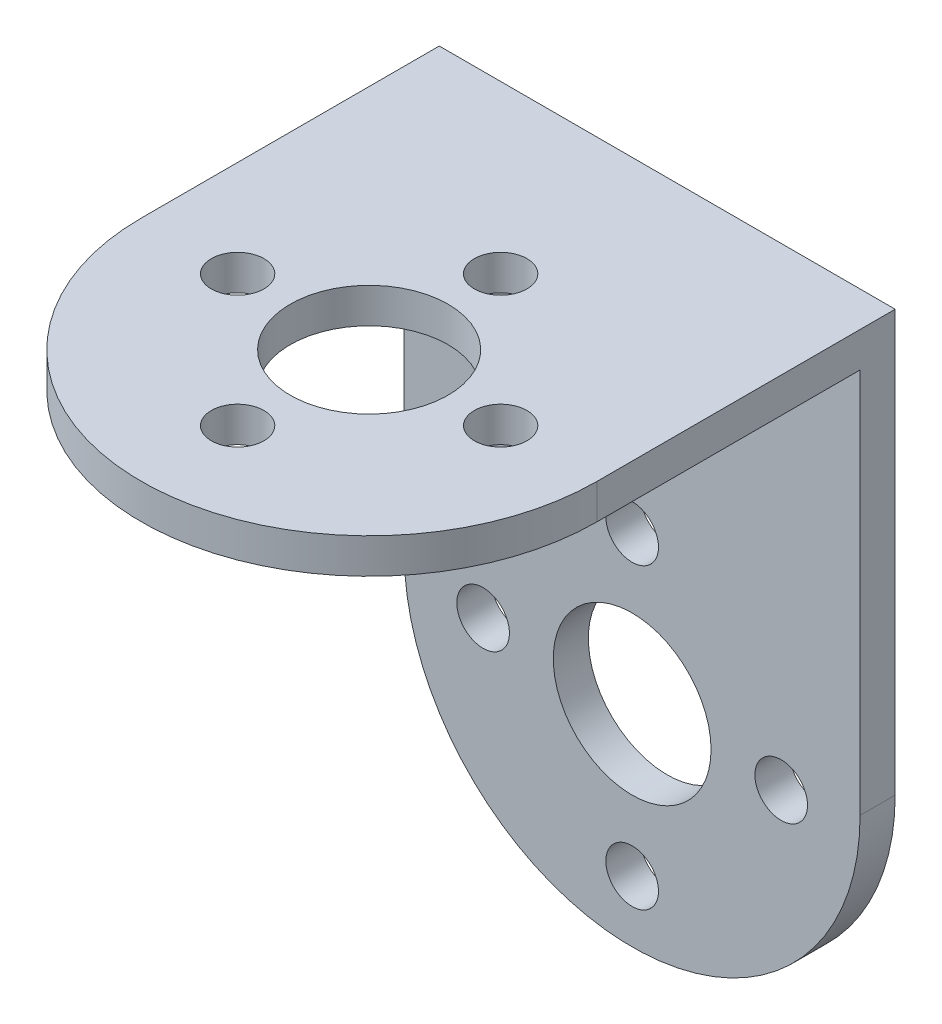
from build123d import *

# Parameters (mm, degrees)
BOSS_EXTRUDE1_DEPTH = 26
SKETCH4_R           = 4.5
SKETCH4_R_2         = 1.5
CUT_EXTRUDE2_DEPTH  = 53.497618994
SKETCH5_R           = 1.5
SKETCH5_R_2         = 4.5
CUT_EXTRUDE3_DEPTH  = 47.273642606


with BuildPart() as part:
    # Sketch2 → Boss-Extrude1 (new body)
    with BuildSketch(Plane(origin=(0, 0, 0), x_dir=(0, 0, -1), z_dir=(1, 0, 0))):
        Polygon((-15.5, 1), (14.5, 1), (14.5, -36), (12.5, -36), (12.5, -1), (-15.5, -1), align=None)
    extrude(amount=BOSS_EXTRUDE1_DEPTH)

    # Sketch4 → Cut-Extrude2 (cut, through all)
    with BuildSketch(Plane.XY.offset(-12.5)):
        with Locations((13, -24)):
            Circle(SKETCH4_R)
        with Locations((4.5, -24)):
            Circle(SKETCH4_R_2)
        with Locations((13, -32.5)):
            Circle(SKETCH4_R_2)
        with Locations((21.5, -24)):
            Circle(SKETCH4_R_2)
        with Locations((13, -15.5)):
            Circle(SKETCH4_R_2)
        with BuildLine():
            ThreePointArc((13, -36), (3.807611845, -32.192388155), (0, -23))
            Line((0, -23), (0, -36))
            Line((0, -36), (13, -36))
        make_face()
        with BuildLine():
            ThreePointArc((26, -23), (22.192388155, -32.192388155), (13, -36))
            Line((13, -36), (26, -36))
            Line((26, -36), (26, -23))
        make_face()
    extrude(amount=-CUT_EXTRUDE2_DEPTH, mode=Mode.SUBTRACT)

    # Sketch5 → Cut-Extrude3 (cut, through all)
    with BuildSketch(Plane.XZ.offset(1)):
        with Locations(Location((5.5, 2.5, 0), (0, 0, 270))):
            Circle(SKETCH5_R)
        with Locations(Location((13, -5, 0), (0, 0, 270))):
            Circle(SKETCH5_R)
        with Locations(Location((13, 2.5, 0), (0, 0, 270))):
            Circle(SKETCH5_R_2)
        with Locations(Location((20.5, 2.5, 0), (0, 0, 270))):
            Circle(SKETCH5_R)
        with BuildLine():
            Line((13, 15.5), (0, 15.5))
            Line((0, 15.5), (0, 2.5))
            ThreePointArc((0, 2.5), (3.807611845, 11.692388155), (13, 15.5))
        make_face()
        with BuildLine():
            Line((26, 15.5), (13, 15.5))
            ThreePointArc((13, 15.5), (22.192388155, 11.692388155), (26, 2.5))
            Line((26, 2.5), (26, 15.5))
        make_face()
        with Locations(Location((13, 10, 0), (0, 0, 270))):
            Circle(SKETCH5_R)
    extrude(amount=-CUT_EXTRUDE3_DEPTH, mode=Mode.SUBTRACT)


solid = part.part
